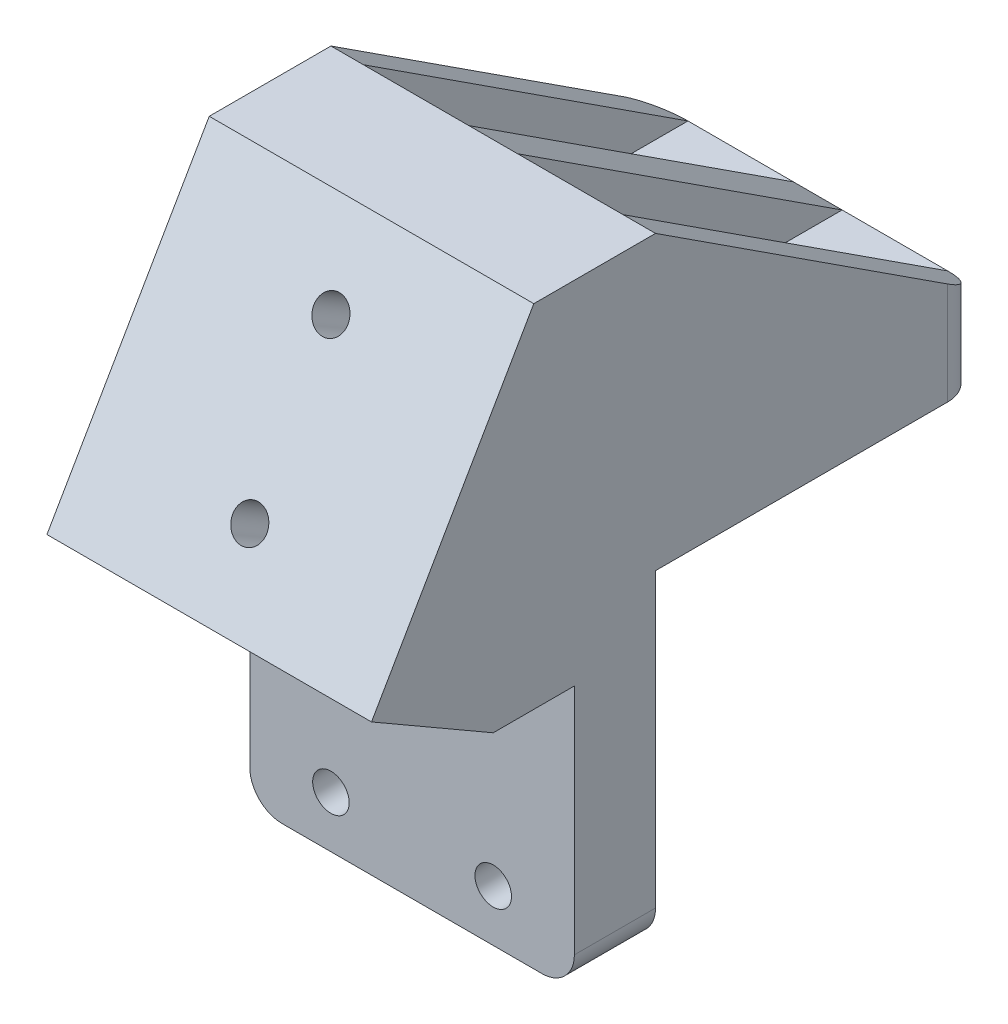
from build123d import *

# Parameters (mm, degrees)
BOSS_EXTRU_1_DEPTH           = 40
ENL_V_MAT_EXTRU_1_DEPTH      = 76.498344353
ENL_V_MAT_EXTRU_1_DEPTH_BACK = 76.498344353
ESQUISSE2_R                  = 2.25
ENL_V_MAT_EXTRU_2_DEPTH      = 76.498344353
ENL_V_MAT_EXTRU_2_DEPTH_BACK = 76.498344353
ESQUISSE3_R                  = 2.25
ENL_V_MAT_EXTRU_3_DEPTH      = 96.640449297
ENL_V_MAT_EXTRU_3_DEPTH_BACK = 20
ESQUISSE4_R                  = 2.1
BOSS_EXTRU_2_DEPTH           = 4
BOSS_EXTRU_3_START           = -40
BOSS_EXTRU_3_DEPTH           = 4
BOSS_EXTRU_4_DEPTH           = 3
BOSS_EXTRU_4_DEPTH_BACK      = 3
BOSS_EXTRU_4_START           = -20
CONG_1_R                     = 4


with BuildPart() as part:
    # Esquisse1 → Boss.-Extru.1 (new body)
    with BuildSketch(Plane(origin=(0, 0, 0), x_dir=(0, 0, -1), z_dir=(1, 0, 0))):
        Polygon((0, 0), (40, 0), (40, 10), (0, 10), (0, 36), (-15, 36), (-35, 1.358983849), (-20, -7.301270189), (-10, -7.301270189), (-10, -40), (0, -40), align=None)
    extrude(amount=BOSS_EXTRU_1_DEPTH)

    # Esquisse2 → Enlèv. mat.-Extru.1 (cut, two sides: drawn at the far end of the back side and taken through both)
    with BuildSketch(Plane(origin=(0, 10, 0), x_dir=(1, 0, 0), z_dir=(0, 1, 0)).offset(-ENL_V_MAT_EXTRU_1_DEPTH_BACK)):
        with Locations(Location((10, 30, 0), (0, 0, 270))):
            Circle(ESQUISSE2_R)
        with Locations(Location((30, 30, 0), (0, 0, 270))):
            Circle(ESQUISSE2_R)
        with Locations(Location((30, 10, 0), (0, 0, 270))):
            Circle(ESQUISSE2_R)
        with Locations(Location((10, 10, 0), (0, 0, 270))):
            Circle(ESQUISSE2_R)
    extrude(amount=ENL_V_MAT_EXTRU_1_DEPTH + ENL_V_MAT_EXTRU_1_DEPTH_BACK, mode=Mode.SUBTRACT)

    # Esquisse3 → Enlèv. mat.-Extru.2 (cut, two sides: drawn at the far end of the back side and taken through both)
    with BuildSketch(Plane.XY.offset(10).offset(-ENL_V_MAT_EXTRU_2_DEPTH_BACK)):
        with Locations((10, -33.650635095)):
            Circle(ESQUISSE3_R)
        with Locations((30, -33.650635095)):
            Circle(ESQUISSE3_R)
        with Locations((30, -13.650635095)):
            Circle(ESQUISSE3_R)
        with Locations((10, -13.650635095)):
            Circle(ESQUISSE3_R)
    extrude(amount=ENL_V_MAT_EXTRU_2_DEPTH + ENL_V_MAT_EXTRU_2_DEPTH_BACK, mode=Mode.SUBTRACT)

    # Esquisse4 → Enlèv. mat.-Extru.3 (cut, two sides: drawn at the far end of the back side and taken through both)
    with BuildSketch(Plane(origin=(0, 15.495190528, 26.838457268), x_dir=(1, 0, 0), z_dir=(0, 0.4999999999999946, 0.8660254037844419)).offset(-ENL_V_MAT_EXTRU_3_DEPTH_BACK)):
        with Locations(Location((20, 13.676914536, 0), (0, 0, 90))):
            Circle(ESQUISSE4_R)
        with Locations(Location((20, -6.323085464, 0), (0, 0, 90))):
            Circle(ESQUISSE4_R)
    extrude(amount=ENL_V_MAT_EXTRU_3_DEPTH + ENL_V_MAT_EXTRU_3_DEPTH_BACK, mode=Mode.SUBTRACT)

    # Esquisse5 → Boss.-Extru.2 (add)
    with BuildSketch(Plane(origin=(40, 0, 0), x_dir=(0, 0, -1), z_dir=(1, 0, 0))):
        Polygon((40, 10), (0, 36), (0, 10), align=None)
    extrude(amount=-BOSS_EXTRU_2_DEPTH)

    # Esquisse5<2> → Boss.-Extru.3 (add)
    with BuildSketch(Plane(origin=(40, 0, 0), x_dir=(0, 0, -1), z_dir=(1, 0, 0)).offset(BOSS_EXTRU_3_START)):
        Polygon((40, 10), (0, 36), (0, 10), align=None)
    extrude(amount=BOSS_EXTRU_3_DEPTH)

    # Esquisse5<3> → Boss.-Extru.4 (add, two sides: drawn at the far end of the back side and taken through both)
    with BuildSketch(Plane(origin=(40, 0, 0), x_dir=(0, 0, -1), z_dir=(1, 0, 0)).offset(BOSS_EXTRU_4_START - BOSS_EXTRU_4_DEPTH_BACK)):
        Polygon((40, 10), (0, 36), (0, 10), align=None)
    extrude(amount=BOSS_EXTRU_4_DEPTH + BOSS_EXTRU_4_DEPTH_BACK)

    # Congé1
    cong_1_edges = [part.edges().sort_by_distance(p)[0] for p in [
        (0, 5, -40),
        (40, 5, -40),
        (0, -40, 5),
        (40, -40, 5),
    ]]
    fillet(cong_1_edges, radius=CONG_1_R)


solid = part.part
